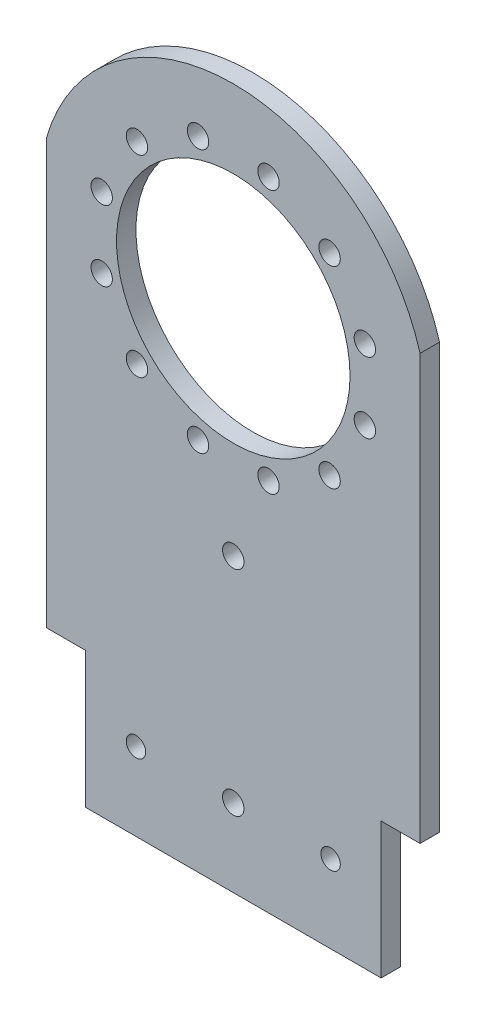
from build123d import *

# Parameters (mm, degrees)
SKETCH_1_R          = 30
EXTRUDE_1_DEPTH     = 5
SKETCH_3_R          = 2.75
CUT_EXTRUDE_2_DEPTH = 20
SKETCH_4_R          = 2.75
CUT_EXTRUDE_3_DEPTH = 10
SKETCH_10_W         = 76
SKETCH_10_H         = 34.93
SKETCH_10_R         = 2.5
SKETCH_10_R_2       = 2.75
EXTRUDE_2_DEPTH     = 5


with BuildPart() as part:
    # 草图1 → 凸台-拉伸1 (new body)
    with BuildSketch(Plane.XY):
        with BuildLine():
            Line((-48, 109.07), (-48, 0))
            Line((-48, 0), (48, 0))
            Line((48, 0), (48, 109.07))
            ThreePointArc((48, 109.07), (0, 145.07), (-48, 109.07))
        make_face()
        with Locations((0, 95.07)):
            Circle(SKETCH_1_R, mode=Mode.SUBTRACT)
    extrude(amount=EXTRUDE_1_DEPTH)

    # 草图3 → 切除-拉伸2 (cut)
    with BuildSketch(Plane.XY.offset(5)):
        with Locations((0, 40)):
            Circle(SKETCH_3_R)
    extrude(amount=-CUT_EXTRUDE_2_DEPTH, mode=Mode.SUBTRACT)

    # 草图4 → 切除-拉伸3 (cut)
    with BuildSketch(Plane.XY.offset(5)):
        with Locations((9.058666579, 128.87740392)):
            Circle(SKETCH_4_R)
        with Locations((24.748737342, 119.818737342)):
            Circle(SKETCH_4_R)
        with Locations((33.80740392, 104.128666579)):
            Circle(SKETCH_4_R)
        with Locations((33.80740392, 86.011333421)):
            Circle(SKETCH_4_R)
        with Locations((24.748737342, 70.321262658)):
            Circle(SKETCH_4_R)
        with Locations((9.058666579, 61.26259608)):
            Circle(SKETCH_4_R)
        with Locations((-9.058666579, 61.26259608)):
            Circle(SKETCH_4_R)
        with Locations((-24.748737342, 70.321262658)):
            Circle(SKETCH_4_R)
        with Locations((-33.80740392, 86.011333421)):
            Circle(SKETCH_4_R)
        with Locations((-33.80740392, 104.128666579)):
            Circle(SKETCH_4_R)
        with Locations((-24.748737342, 119.818737342)):
            Circle(SKETCH_4_R)
        with Locations((-9.058666579, 128.87740392)):
            Circle(SKETCH_4_R)
    extrude(amount=-CUT_EXTRUDE_3_DEPTH, mode=Mode.SUBTRACT)

    # 草图10 → 凸台-拉伸2 (add)
    with BuildSketch(Plane.XY.offset(5)):
        with Locations((0, -17.465)):
            Rectangle(SKETCH_10_W, SKETCH_10_H)
        with Locations((25, -14.93)):
            Circle(SKETCH_10_R, mode=Mode.SUBTRACT)
        with Locations((-25, -14.93)):
            Circle(SKETCH_10_R, mode=Mode.SUBTRACT)
        with Locations((0, -14.93)):
            Circle(SKETCH_10_R_2, mode=Mode.SUBTRACT)
    extrude(amount=-EXTRUDE_2_DEPTH)


solid = part.part
